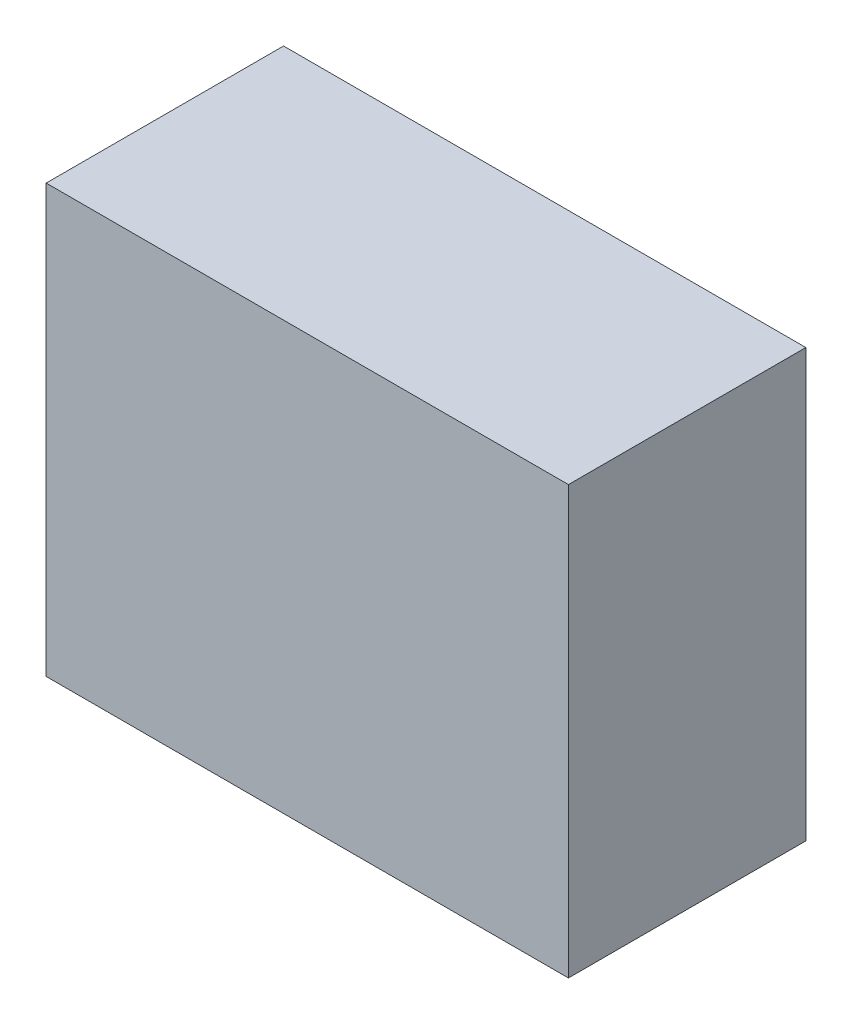
from build123d import *

# Parameters (mm, degrees)
SKETCH1_W           = 209.55
SKETCH1_H           = 171.45
BOSS_EXTRUDE1_DEPTH = 95.25


with BuildPart() as part:
    # Sketch1 → Boss-Extrude1 (new body)
    with BuildSketch(Plane.XY):
        Rectangle(SKETCH1_W, SKETCH1_H)
    extrude(amount=BOSS_EXTRUDE1_DEPTH)


solid = part.part
